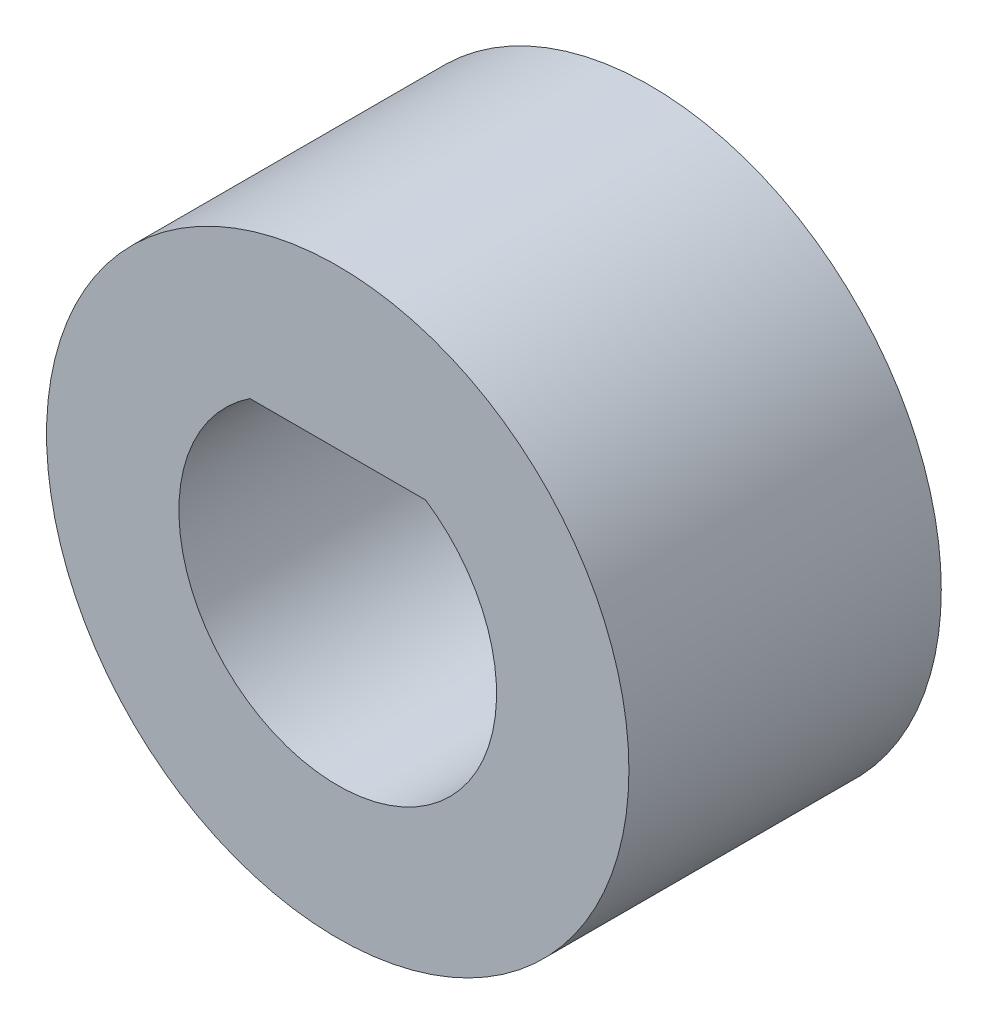
from build123d import *

# Parameters (mm, degrees)
SKETCH_1_R      = 2.75
EXTRUDE_1_DEPTH = 2.95


with BuildPart() as part:
    # 草图1 → 凸台-拉伸1 (new body)
    with BuildSketch(Plane.XY):
        Circle(SKETCH_1_R)
        with BuildLine():
            Line((-0.829156198, 1.25), (0.829156198, 1.25))
            ThreePointArc((0.829156198, 1.25), (0, -1.5), (-0.829156198, 1.25))
        make_face(mode=Mode.SUBTRACT)
    extrude(amount=EXTRUDE_1_DEPTH)


solid = part.part
